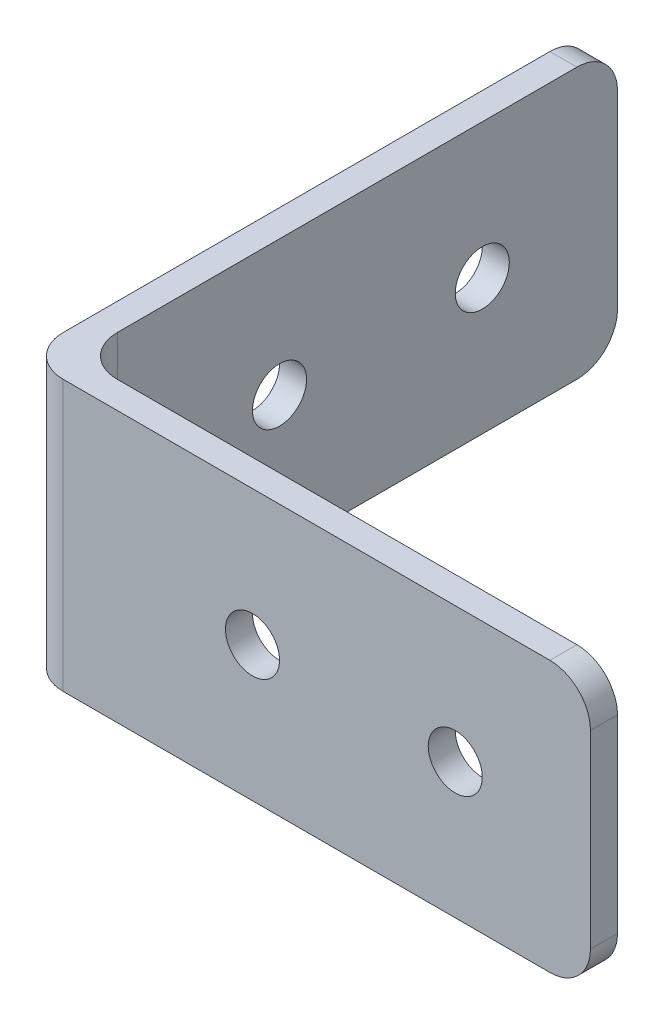
from build123d import *

# Parameters (mm, degrees)
BOSS_EXTRUDE1_DEPTH = 20
FILLET1_R           = 3
SKETCH3_R           = 2
CUT_EXTRUDE1_DEPTH  = 52.909473261
SKETCH4_R           = 2
CUT_EXTRUDE2_DEPTH  = 51.587344223


with BuildPart() as part:
    # Sketch1 → Boss-Extrude1 (new body)
    with BuildSketch(Plane(origin=(0, 0, 0), x_dir=(1, 0, 0), z_dir=(0, 1, 0))):
        Polygon((-13.644859813, 18.355140187), (-13.644859813, -21.644859813), (26.355140187, -21.644859813), (26.355140187, -23.644859813), (-15.644859813, -23.644859813), (-15.644859813, 18.355140187), align=None)
    extrude(amount=BOSS_EXTRUDE1_DEPTH)

    # Fillet1
    fillet1_edges = [part.edges().sort_by_distance(p)[0] for p in [
        (-13.644859813, 10, 21.644859813),
        (-15.644859813, 10, 23.644859813),
        (26.355140187, 20, 22.644859813),
        (-14.644859813, 20, -18.355140187),
        (26.355140187, 0, 22.644859813),
        (-14.644859813, 0, -18.355140187),
    ]]
    fillet(fillet1_edges, radius=FILLET1_R)

    # Sketch3 → Cut-Extrude1 (cut, through all)
    with BuildSketch(Plane(origin=(0, 0, 21.644859813), x_dir=(-1, 0, 0), z_dir=(0, 0, -1))):
        with Locations((-1.355140187, 10)):
            Circle(SKETCH3_R)
        with Locations((-16.355140187, 10)):
            Circle(SKETCH3_R)
    extrude(amount=-CUT_EXTRUDE1_DEPTH, mode=Mode.SUBTRACT)

    # Sketch4 → Cut-Extrude2 (cut, through all)
    with BuildSketch(Plane(origin=(-13.644859813, 0, 0), x_dir=(0, 0, -1), z_dir=(1, 0, 0))):
        with Locations((8.355140187, 10)):
            Circle(SKETCH4_R)
        with Locations((-6.644859813, 10)):
            Circle(SKETCH4_R)
    extrude(amount=-CUT_EXTRUDE2_DEPTH, mode=Mode.SUBTRACT)


solid = part.part
